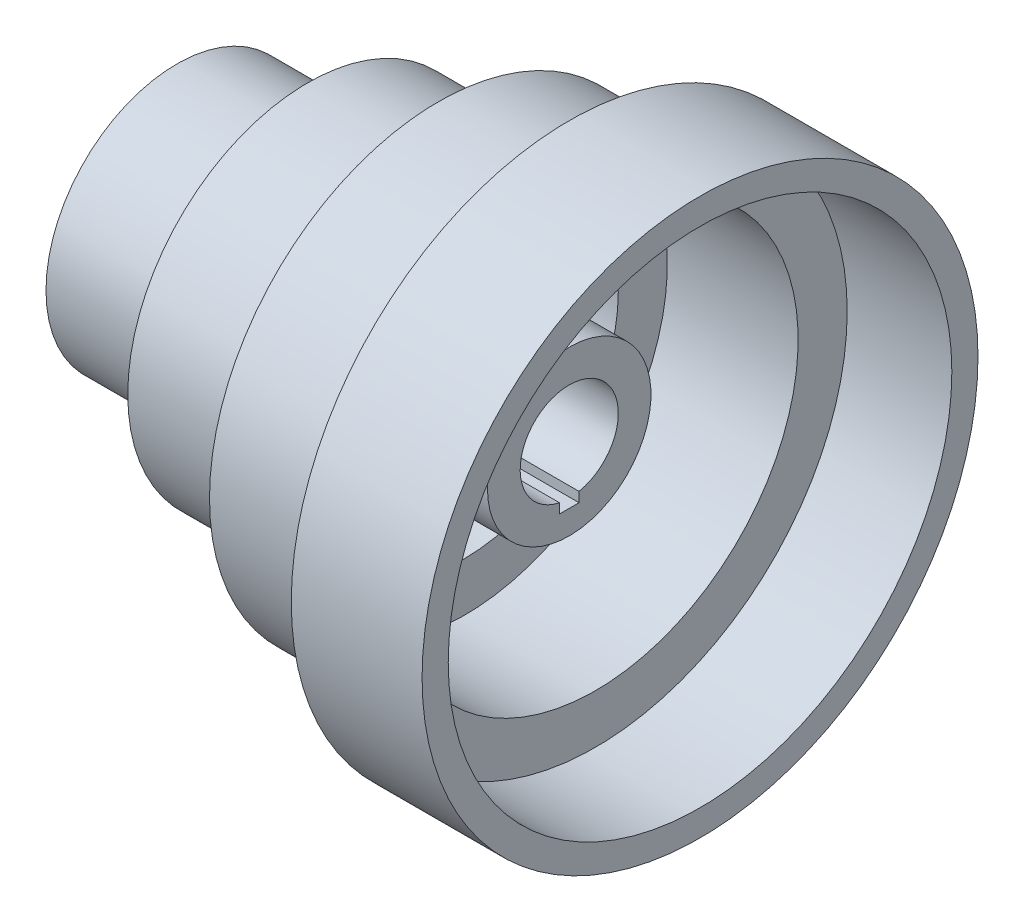
from build123d import *

# Parameters (mm, degrees)
CUT_EXTRUDE1_DEPTH      = 201.124960962
CUT_EXTRUDE1_DEPTH_BACK = 201.124960962


with BuildPart() as part:
    # Sketch2 → Revolve1 (revolve)
    with BuildSketch(Plane.XY, mode=Mode.PRIVATE) as revolve1_sk:
        Polygon((0, 15), (120, 15), (120, 25), (48, 25), (48, 47), (88, 47), (88, 62), (128, 62), (128, 77), (160, 77), (160, 85), (120, 85), (120, 70), (80, 70), (80, 55), (40, 55), (40, 40), (0, 40), align=None)
    revolve(revolve1_sk.sketch.rotate(Axis((-111.650485437, 0, 0), (1, 0, 0)), 90), axis=Axis((-111.650485437, 0, 0), (1, 0, 0)))

    # Sketch3 → Cut-Extrude1 (cut, two sides: drawn at the far end of the back side and taken through both)
    with BuildSketch(Plane.ZY.offset(-CUT_EXTRUDE1_DEPTH_BACK)):
        with BuildLine():
            Line((-3, -14.696938457), (-3, -17.696938457))
            Line((-3, -17.696938457), (3, -17.696938457))
            Line((3, -17.696938457), (3, -14.696938457))
            ThreePointArc((3, -14.696938457), (0, 15), (-3, -14.696938457))
        make_face()
    extrude(amount=CUT_EXTRUDE1_DEPTH + CUT_EXTRUDE1_DEPTH_BACK, mode=Mode.SUBTRACT)


solid = part.part
